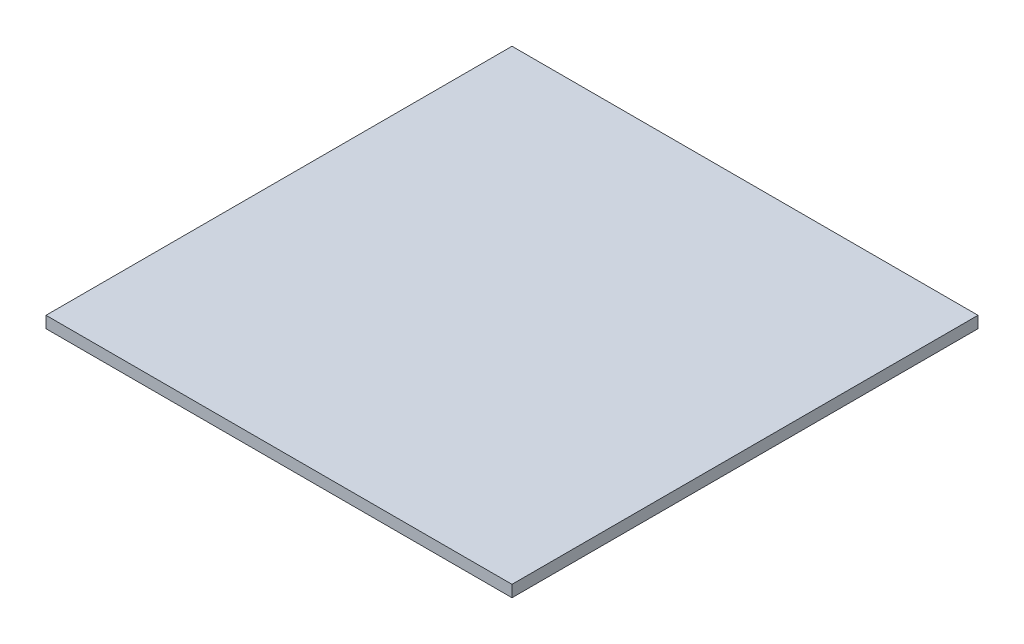
from build123d import *

# Parameters (mm, degrees)
SKETCH1_W           = 127
SKETCH1_H           = 127
BOSS_EXTRUDE1_DEPTH = 3.175


with BuildPart() as part:
    # Sketch1 → Boss-Extrude1 (new body)
    with BuildSketch(Plane(origin=(0, 0, 0), x_dir=(1, 0, 0), z_dir=(0, 1, 0))):
        Rectangle(SKETCH1_W, SKETCH1_H)
    extrude(amount=BOSS_EXTRUDE1_DEPTH)


solid = part.part
